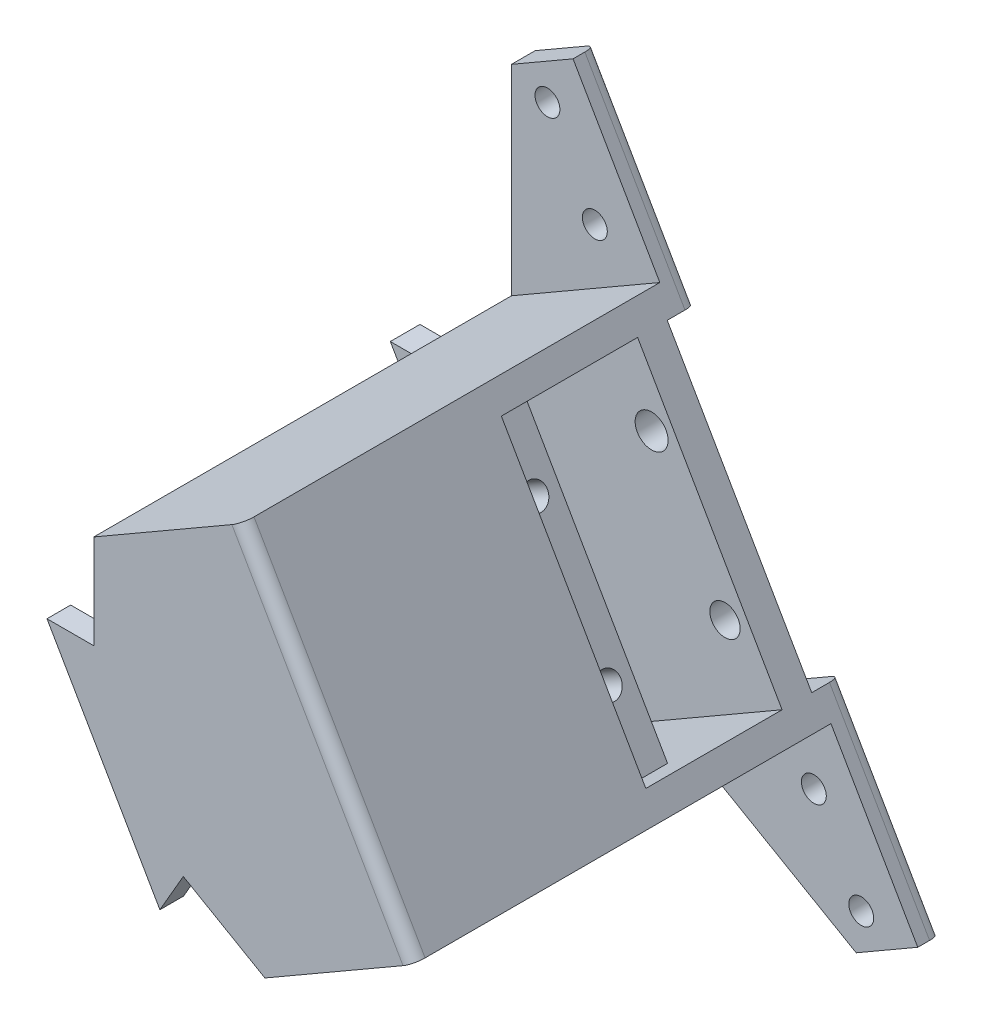
from build123d import *

# Parameters (mm, degrees)
SKETCH_1_R          = 2.1
EXTRUDE_1_DEPTH     = 5
EXTRUDE_2_DEPTH     = 5
EXTRUDE_3_DEPTH     = 10
SKETCH_4_R          = 2.1
CUT_EXTRUDE_1_DEPTH = 10
SKETCH_5_R          = 2.1
CUT_EXTRUDE_2_DEPTH = 157.444761979
CUT_EXTRUDE_3_DEPTH = 6
EXTRUDE_4_DEPTH     = 64.5
EXTRUDE_5_DEPTH     = 4
SKETCH_9_W          = 49.5
SKETCH_9_H          = 57.77011897
EXTRUDE_6_DEPTH     = 10
SKETCH_10_W         = 5
SKETCH_10_H         = 48.77011897
CUT_EXTRUDE_4_DEPTH = 10
CUT_EXTRUDE_5_REACH = 172.895
SKETCH_11_R         = 2.5629981
SKETCH_11_R_2       = 2.780591795
FILLET_1_R          = 2
SKETCH_12_R         = 2.1
CUT_EXTRUDE_6_DEPTH = 10
SKETCH_13_W         = 8
SKETCH_13_H         = 48.77011897
CUT_EXTRUDE_7_DEPTH = 5


with BuildPart() as part:
    # 草圖1 → 填料-伸長1 (new body)
    # profile 1 of 2: a face of its own
    with BuildSketch(Plane.XY):
        Polygon((46.554726499, 40.372196633), (35.007721115, 40.372196633), (59.841223807, -2.64069176), (65.614726499, 7.35930824), align=None)
        with Locations((56.75459948, 12.705498399)):
            Circle(SKETCH_1_R, mode=Mode.SUBTRACT)
        with Locations((46.75459948, 30.026006474)):
            Circle(SKETCH_1_R, mode=Mode.SUBTRACT)
    # profile 2 of 2: a face of its own
    with BuildSketch(Plane.XY):
        Polygon((54.456814697, 40.372196633), (46.554726499, 40.372196633), (65.614726499, 7.35930824), (69.565770598, 14.202717363), align=None)
    extrude(amount=EXTRUDE_1_DEPTH)

    # 草圖2 → 填料-伸長2 (add)
    with BuildSketch(Plane.XY.offset(5)):
        Polygon((54.456814697, 40.372196633), (69.565770598, 14.202717363), (65.614726499, 7.35930824), (46.554726499, 40.372196633), align=None)
    extrude(amount=EXTRUDE_2_DEPTH)

    # 草圖3 → 填料-伸長3 (add)
    with BuildSketch(Plane(origin=(0, 0, 0), x_dir=(-1, 0, 0), z_dir=(0, 0, -1))):
        Polygon((-69.565770598, 14.202717363), (-112.641874182, -10.667282637), (-123.034179028, -4.667282637), (-64.849119543, 96.112196633), (-54.456814697, 90.112196633), (-54.456814697, 40.372196633), align=None)
    extrude(amount=-EXTRUDE_3_DEPTH)

    # 草圖4 → 除料-伸長1 (cut)
    with BuildSketch(Plane(origin=(0, 0, 0), x_dir=(-1, 0, 0), z_dir=(0, 0, -1))):
        with Locations((-113.495975798, -4.146630029)):
            Circle(SKETCH_4_R)
        with Locations((-105.495975798, 9.709776431)):
            Circle(SKETCH_4_R)
    extrude(amount=-CUT_EXTRUDE_1_DEPTH, mode=Mode.SUBTRACT)

    # 草圖5 → 除料-伸長2 (cut, through all)
    with BuildSketch(Plane(origin=(0, 0, 0), x_dir=(-1, 0, 0), z_dir=(0, 0, -1))):
        with Locations((-60.530916312, 87.591544025)):
            Circle(SKETCH_5_R)
        with Locations((-68.530916312, 73.735137564)):
            Circle(SKETCH_5_R)
    extrude(amount=-CUT_EXTRUDE_2_DEPTH, mode=Mode.SUBTRACT)

    # 草圖6 → 除料-伸長3 (cut)
    with BuildSketch(Plane.XY.offset(10)):
        Polygon((79.499119543, 70.737652302), (54.456814697, 56.279470858), (54.456814697, 90.112196633), (64.849119543, 96.112196633), align=None)
        Polygon((83.341874182, 6.24908025), (108.384179028, 20.707261694), (123.034179028, -4.667282637), (112.641874182, -10.667282637), align=None)
    extrude(amount=-CUT_EXTRUDE_3_DEPTH, mode=Mode.SUBTRACT)

    # 草圖7 → 填料-伸長4 (add)
    with BuildSketch(Plane.XY.offset(10)):
        Polygon((78.841874182, 8.847156461), (106.134179028, 24.604376011), (108.384179028, 20.707261694), (83.341874182, 6.24908025), align=None)
        Polygon((54.456814697, 56.279470858), (79.499119543, 70.737652302), (81.749119543, 66.840537985), (54.456814697, 51.083318435), align=None)
    extrude(amount=EXTRUDE_4_DEPTH)

    # 草圖8 → 填料-伸長5 (add)
    with BuildSketch(Plane.XY.offset(74.5)):
        Polygon((79.499119543, 70.737652302), (108.384179028, 20.707261694), (83.341874182, 6.24908025), (69.565770598, 14.202717363), (65.614726499, 7.35930824), (46.554726499, 40.372196633), (54.456814697, 40.372196633), (54.456814697, 56.279470858), align=None)
    extrude(amount=-EXTRUDE_5_DEPTH)

    # 草圖9 → 填料-伸長6 (add)
    with BuildSketch(Plane(origin=(90.254641606, 52.108541627, 0), x_dir=(0, 0, -1), z_dir=(0.8660254037844403, 0.4999999999999973, 0))):
        with Locations((-49.75, -7.374015359)):
            Rectangle(SKETCH_9_W, SKETCH_9_H)
    extrude(amount=-EXTRUDE_6_DEPTH)

    # 草圖10 → 除料-伸長4 (cut)
    with BuildSketch(Plane(origin=(90.254641606, 52.108541627, 0), x_dir=(0, 0, -1), z_dir=(0.8660254037844403, 0.4999999999999973, 0))):
        with Locations((-2.5, -7.374015359)):
            Rectangle(SKETCH_10_W, SKETCH_10_H)
    extrude(amount=-CUT_EXTRUDE_4_DEPTH, mode=Mode.SUBTRACT)

    # 草圖11 → 除料-伸長5 (cut, up to next)
    with BuildSketch(Plane(origin=(0, 0, 5), x_dir=(-1, 0, 0), z_dir=(0, 0, -1)), mode=Mode.PRIVATE) as cut_extrude_5_sk1:
        with Locations(Location((-96.496872332, 32.896680856, 0), (0, 0, 90))):
            Circle(SKETCH_11_R)
    cut_extrude_5_tool1 = extrude(cut_extrude_5_sk1.sketch, amount=-CUT_EXTRUDE_5_REACH, mode=Mode.PRIVATE) & part.part
    # 草圖11 → 除料-伸長5 (cut, up to next)
    with BuildSketch(Plane(origin=(0, 0, 5), x_dir=(-1, 0, 0), z_dir=(0, 0, -1)), mode=Mode.PRIVATE) as cut_extrude_5_sk2:
        with Locations(Location((-84.111812847, 54.348233139, 0), (0, 0, 90))):
            Circle(SKETCH_11_R_2)
    cut_extrude_5_tool2 = extrude(cut_extrude_5_sk2.sketch, amount=-CUT_EXTRUDE_5_REACH, mode=Mode.PRIVATE) & part.part
    add(cut_extrude_5_tool1.solids().sort_by_distance((96.496872, 32.896681, 5))[0], mode=Mode.SUBTRACT)
    add(cut_extrude_5_tool2.solids().sort_by_distance((84.111813, 54.348233, 5))[0], mode=Mode.SUBTRACT)

    # 圓角1
    fillet_1_edges = [part.edges().sort_by_distance(p)[0] for p in [
        (93.941649285, 45.722456998, 74.5),
        (114.584179028, 9.968546687, 0),
        (73.299119543, 81.476367309, 0),
    ]]
    fillet(fillet_1_edges, radius=FILLET_1_R)

    # 草圖12 → 除料-伸長6 (cut)
    with BuildSketch(Plane(origin=(90.254641606, 52.108541627, 0), x_dir=(0, 0, -1), z_dir=(0.8660254037844403, 0.4999999999999973, 0))):
        with Locations(Location((-29, -19.759074844, 0), (0, 0, 90))):
            Circle(SKETCH_12_R)
        with Locations(Location((-29, 5.011044126, 0), (0, 0, 90))):
            Circle(SKETCH_12_R)
    extrude(amount=-CUT_EXTRUDE_6_DEPTH, mode=Mode.SUBTRACT)

    # 草圖13 → 除料-伸長7 (cut)
    with BuildSketch(Plane(origin=(90.254641606, 52.108541627, 0), x_dir=(0, 0, -1), z_dir=(0.8660254037844403, 0.4999999999999973, 0))):
        with Locations((-29, -7.374015359)):
            Rectangle(SKETCH_13_W, SKETCH_13_H)
    extrude(amount=-CUT_EXTRUDE_7_DEPTH, mode=Mode.SUBTRACT)


solid = part.part
